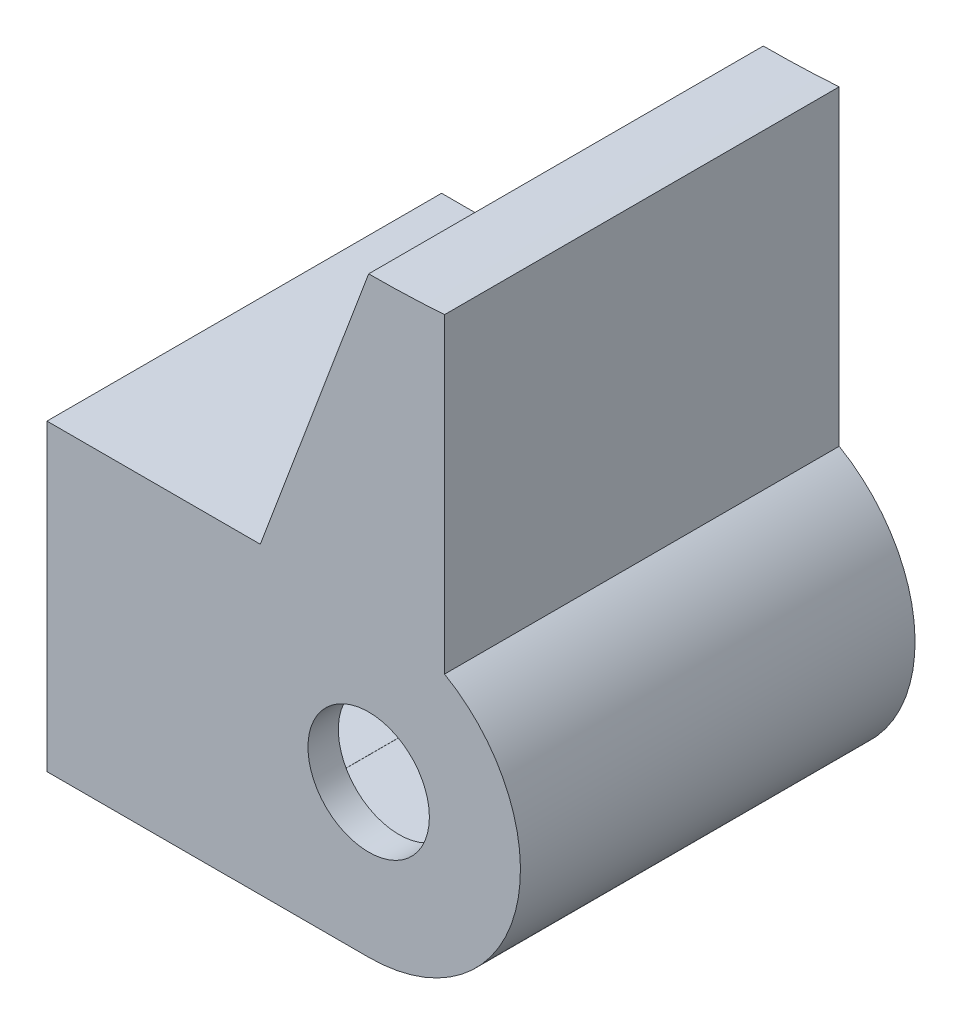
from build123d import *

# Parameters (mm, degrees)
EXTRUDE_1_DEPTH     = 130
SHELL_2_T           = -10
SKETCH_2_W          = 10
SKETCH_2_H          = 80.0247511
CUT_EXTRUDE_1_DEPTH = 120
SKETCH_3_R          = 20
CUT_EXTRUDE_2_DEPTH = 10


with BuildPart() as part:
    # 草图1 → 凸台-拉伸1 (new body)
    with BuildSketch(Plane.XY):
        with BuildLine():
            Line((574.017492235, -50), (620, -50))
            ThreePointArc((620, -50), (668.296291314, -12.940952255), (645, 43.301270189))
            Line((645, 43.301270189), (645, 145.857170879))
            ThreePointArc((645, 145.857170879), (632.507345261, 145.214355663), (620, 145))
            Line((620, 145), (584.288816548, 50))
            Line((584.288816548, 50), (514.017492235, 50))
            Line((514.017492235, 50), (514.017492235, 22.675903866))
            Line((514.017492235, 22.675903866), (514.017492235, -50.0247511))
            Line((514.017492235, -50.0247511), (573.94648172, -50.0247511))
            Line((573.94648172, -50.0247511), (574.017492235, -50))
        make_face()
    extrude(amount=EXTRUDE_1_DEPTH)

    # 抽壳2
    shell_2_openings = [part.faces().sort_by_distance(p)[0] for p in [
        (594.932550523, 20.025269894, 0),
    ]]
    offset(amount=SHELL_2_T, openings=shell_2_openings, kind=Kind.INTERSECTION)

    # 草图2 → 切除-拉伸1 (cut)
    with BuildSketch(Plane(origin=(0, 0, 0), x_dir=(-1, 0, 0), z_dir=(0, 0, -1))):
        with Locations((-519.017492235, -0.01237555)):
            Rectangle(SKETCH_2_W, SKETCH_2_H)
    extrude(amount=-CUT_EXTRUDE_1_DEPTH, mode=Mode.SUBTRACT)

    # 草图3 → 切除-拉伸2 (cut)
    with BuildSketch(Plane.XY.offset(130)):
        with Locations((620, 0)):
            Circle(SKETCH_3_R)
    extrude(amount=-CUT_EXTRUDE_2_DEPTH, mode=Mode.SUBTRACT)


solid = part.part
